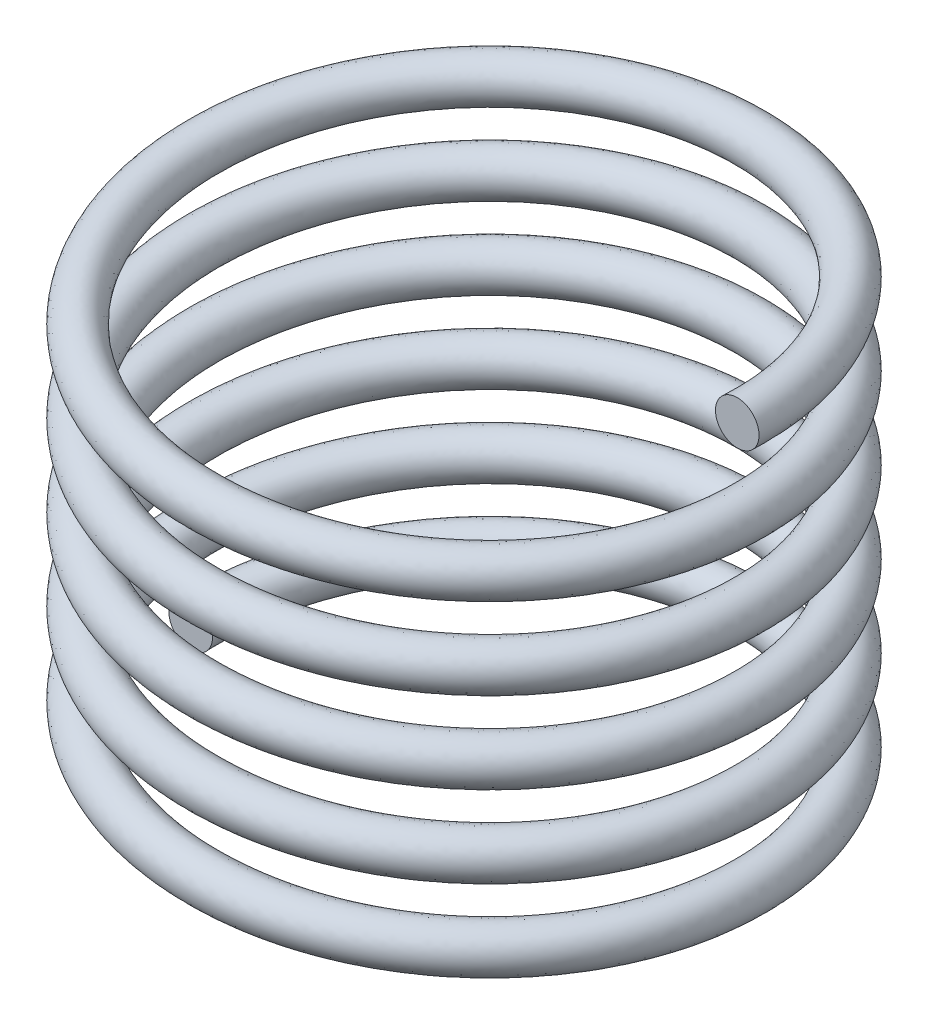
from build123d import *

# Parameters (mm, degrees)
SWEEP1_PITCH       = 4.271818182
SWEEP1_HEIGHT      = 23.495
SWEEP1_RADIUS      = 14.3256
SWEEP1_START_ANGLE = -90
SKETCH1_R          = 1.143


with BuildPart() as part:
    # Sweep1: sweep along a helix
    with BuildLine() as sweep1_path:
        add(Helix(SWEEP1_PITCH, SWEEP1_HEIGHT, SWEEP1_RADIUS, center=(0, 0, 0), direction=(0, 1, 0), lefthand=True, mode=Mode.PRIVATE).rotate(Axis((0, 0, 0), (0, 1, 0)), SWEEP1_START_ANGLE))
    # Sketch1 → Sweep1 (sweep)
    with BuildSketch(Plane.XY):
        with Locations((-14.3256, 0)):
            Circle(SKETCH1_R)
    sweep(path=sweep1_path.line, is_frenet=True)


solid = part.part
